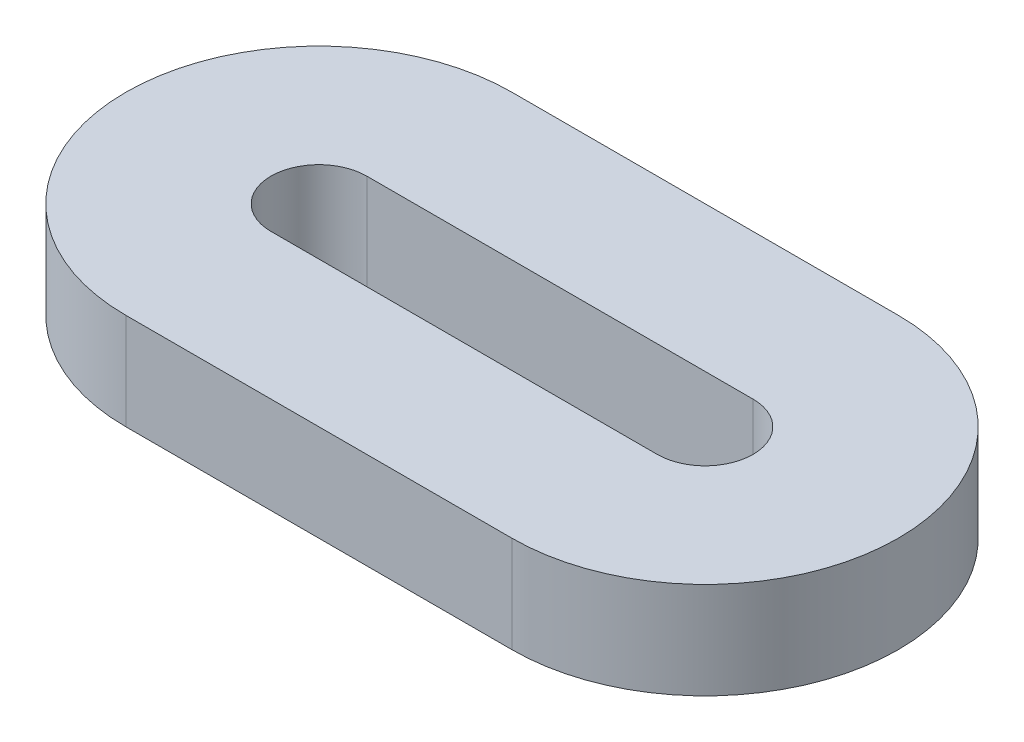
from build123d import *

# Parameters (mm, degrees)
BOSS_EXTRUDE1_DEPTH = 6.35


with BuildPart() as part:
    # Sketch1 → Boss-Extrude1 (new body)
    with BuildSketch(Plane(origin=(0, 0, 0), x_dir=(1, 0, 0), z_dir=(0, 1, 0))):
        with BuildLine():
            Line((-12.7, 12.7), (12.7, 12.7))
            ThreePointArc((12.7, 12.7), (25.4, 0), (12.7, -12.7))
            Line((12.7, -12.7), (-12.7, -12.7))
            ThreePointArc((-12.7, -12.7), (-25.4, 0), (-12.7, 12.7))
        make_face()
        with BuildLine():
            Line((-12.7, 3.15), (12.7, 3.15))
            ThreePointArc((12.7, 3.15), (15.85, 0), (12.7, -3.15))
            Line((12.7, -3.15), (-12.7, -3.15))
            ThreePointArc((-12.7, -3.15), (-15.85, 0), (-12.7, 3.15))
        make_face(mode=Mode.SUBTRACT)
    extrude(amount=BOSS_EXTRUDE1_DEPTH)


solid = part.part
